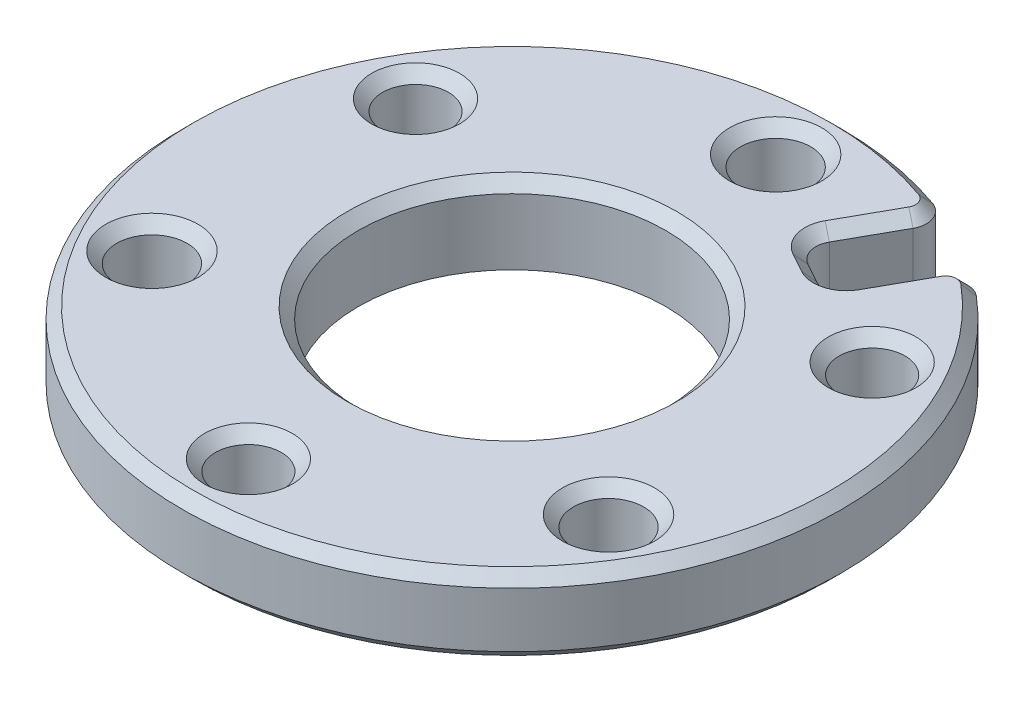
from build123d import *

# Parameters (mm, degrees)
SKETCH_1_R          = 15
SKETCH_1_R_2        = 1.6
SKETCH_1_R_3        = 1.5
SKETCH_1_R_4        = 7
EXTRUDE_1_DEPTH     = 3.5
CUT_EXTRUDE_1_DEPTH = 8
FILLET_1_R          = 1
FILLET_2_R          = 1
CHAMFER_1_SIZE      = 0.5


with BuildPart() as part:
    # 草图1 → 凸台-拉伸1 (new body)
    with BuildSketch(Plane(origin=(0, 0, 0), x_dir=(1, 0, 0), z_dir=(0, 1, 0))):
        with Locations(Location((0, 0, 0), (0, 0, 270))):
            Circle(SKETCH_1_R)
        with Locations(Location((0, 12, 0), (0, 0, 270))):
            Circle(SKETCH_1_R_2, mode=Mode.SUBTRACT)
        with Locations(Location((10.392304845, -6, 0), (0, 0, 270))):
            Circle(SKETCH_1_R_2, mode=Mode.SUBTRACT)
        with Locations(Location((-10.392304845, -6, 0), (0, 0, 270))):
            Circle(SKETCH_1_R_2, mode=Mode.SUBTRACT)
        with Locations(Location((10.392304845, 6, 0), (0, 0, 270))):
            Circle(SKETCH_1_R_3, mode=Mode.SUBTRACT)
        with Locations(Location((0, -12, 0), (0, 0, 270))):
            Circle(SKETCH_1_R_3, mode=Mode.SUBTRACT)
        with Locations(Location((-10.392304845, 6, 0), (0, 0, 270))):
            Circle(SKETCH_1_R_3, mode=Mode.SUBTRACT)
        with Locations(Location((0, 0, 0), (0, 0, 270))):
            Circle(SKETCH_1_R_4, mode=Mode.SUBTRACT)
    extrude(amount=EXTRUDE_1_DEPTH)

    # 草图2 → 切除-拉伸1 (cut)
    with BuildSketch(Plane(origin=(0, 3.5, 0), x_dir=(1, 0, 0), z_dir=(0, 1, 0))):
        Polygon((3.690349309, 9.391530065), (6.310792277, 7.930955296), (9.125758213, 12.981335358), (6.505315246, 14.441910127), align=None)
    extrude(amount=-CUT_EXTRUDE_1_DEPTH, mode=Mode.SUBTRACT)

    # 圆角1
    fillet_1_edges = [part.edges().sort_by_distance(p)[0] for p in [
        (8.700707091, 1.75, -12.218743639),
        (6.095052455, 1.75, -13.705850414),
    ]]
    fillet(fillet_1_edges, radius=FILLET_1_R)

    # 圆角2
    fillet_2_edges = [part.edges().sort_by_distance(p)[0] for p in [
        (6.310792277, 1.75, -7.930955296),
        (3.690349309, 1.75, -9.391530065),
    ]]
    fillet(fillet_2_edges, radius=FILLET_2_R)

    # 倒角1
    chamfer_1_edges = [part.edges().sort_by_distance(p)[0] for p in [
        (10.392304845, 0, 4.4),
        (10.392304845, 3.5, 4.4),
        (-10.392304845, 0, 4.4),
        (-10.392304845, 3.5, 4.4),
        (0, 3.5, -7),
        (0, 0, 10.5),
        (0, 3.5, 10.5),
        (-10.392304845, 0, -7.5),
        (-10.392304845, 3.5, -7.5),
        (0, 0, -13.6),
        (0, 3.5, -13.6),
        (-7.446160806, 3.5, 13.021316725),
        (-7.446160806, 0, 13.021316725),
        (4.859185687, 3.5, -11.488560036),
        (5.603157458, 3.5, -13.552361106),
        (8.827728967, 3.5, -11.700311046),
        (4.859185687, 0, -11.488560036),
        (5.603157458, 0, -13.552361106),
        (8.827728967, 0, -11.700311046),
        (7.466276221, 3.5, -10.004029432),
        (7.466276221, 0, -10.004029432),
        (5.000570793, 3.5, -8.661242681),
        (5.000570793, 0, -8.661242681),
        (6.1975531, 3.5, -8.329389436),
        (6.1975531, 0, -8.329389436),
        (4.08878345, 3.5, -9.504769242),
        (4.08878345, 0, -9.504769242),
        (10.392304845, 0, -7.5),
        (10.392304845, 3.5, -7.5),
    ]]
    chamfer(chamfer_1_edges, length=CHAMFER_1_SIZE)


solid = part.part
